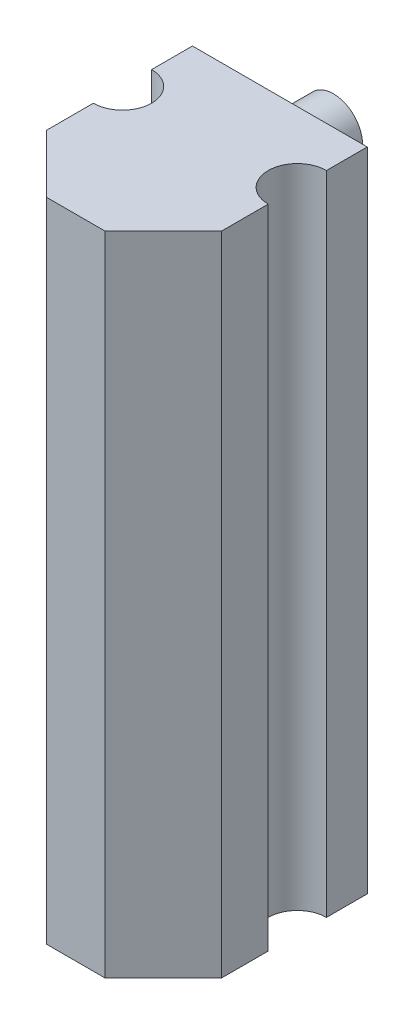
from build123d import *

# Parameters (mm, degrees)
SKETCH1_W           = 30
SKETCH1_H           = 111
BOSS_EXTRUDE1_DEPTH = 35
CUT_EXTRUDE1_DEPTH  = 118.456302638
SKETCH3_R           = 5
BOSS_EXTRUDE2_DEPTH = 10


with BuildPart() as part:
    # Sketch1 → Boss-Extrude1 (new body)
    with BuildSketch(Plane.XY):
        with Locations((0.810851631, 0)):
            Rectangle(SKETCH1_W, SKETCH1_H)
    extrude(amount=BOSS_EXTRUDE1_DEPTH)

    # Sketch2 → Cut-Extrude1 (cut, through all)
    with BuildSketch(Plane(origin=(0, 55.5, 0), x_dir=(1, 0, 0), z_dir=(0, 1, 0))):
        Polygon((5.810851631, -35), (15.810851631, -25), (15.810851631, -35), align=None)
        with BuildLine():
            Line((15.810851631, -7), (15.810851631, -17))
            ThreePointArc((15.810851631, -17), (10.810851631, -12), (15.810851631, -7))
        make_face()
        Polygon((-14.189148369, -25), (-14.189148369, -35), (-4.189148369, -35), align=None)
        with BuildLine():
            Line((-14.189148369, -7), (-14.189148369, -17))
            ThreePointArc((-14.189148369, -17), (-9.189148369, -12), (-14.189148369, -7))
        make_face()
    extrude(amount=-CUT_EXTRUDE1_DEPTH, mode=Mode.SUBTRACT)

    # Sketch3 → Boss-Extrude2 (add)
    with BuildSketch(Plane(origin=(0, 0, 0), x_dir=(-1, 0, 0), z_dir=(0, 0, -1))):
        with Locations(Location((0, 45.5, 0), (0, 0, 180))):
            Circle(SKETCH3_R)
        with Locations(Location((0, -45.5, 0), (0, 0, 180))):
            Circle(SKETCH3_R)
    extrude(amount=BOSS_EXTRUDE2_DEPTH)


solid = part.part
